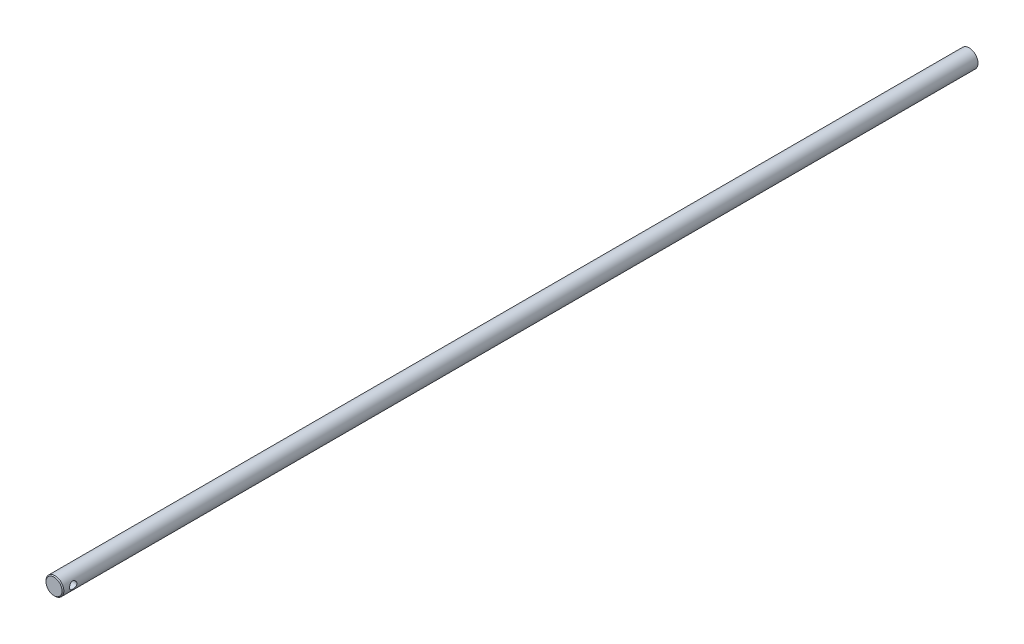
from build123d import *

# Parameters (mm, degrees)
EXTRUDE_1_DEPTH          = 25.6
EXTRUDE_1_DEPTH_BACK     = 1000
SKETCH_1_R               = 10
CUT_EXTRUDE_1_DEPTH      = 1001.530359359
CUT_EXTRUDE_1_DEPTH_BACK = 1001.530359359
SKETCH_2_R               = 4.1
CHAMFER_1_SIZE           = 1


with BuildPart() as part:
    # Эскиз1 → Бобышка-Вытянуть1 (new, two sides: drawn at the far end of the back side and taken through both)
    with BuildSketch(Plane.XY.offset(-EXTRUDE_1_DEPTH_BACK)):
        with Locations((21, 0)):
            Circle(SKETCH_1_R)
    extrude(amount=EXTRUDE_1_DEPTH + EXTRUDE_1_DEPTH_BACK)

    # Эскиз2 → Вырез-Вытянуть1 (cut, two sides: drawn at the far end of the back side and taken through both)
    with BuildSketch(Plane(origin=(0, 0, 0), x_dir=(0, 0, -1), z_dir=(1, 0, 0)).offset(-CUT_EXTRUDE_1_DEPTH_BACK)):
        with Locations(Location((-14, 0, 0), (0, 0, 180))):
            Circle(SKETCH_2_R)
    extrude(amount=CUT_EXTRUDE_1_DEPTH + CUT_EXTRUDE_1_DEPTH_BACK, mode=Mode.SUBTRACT)

    # Фаска1
    chamfer_1_edges = [part.edges().sort_by_distance(p)[0] for p in [
        (11, 0, 25.6),
    ]]
    chamfer(chamfer_1_edges, length=CHAMFER_1_SIZE)


solid = part.part
